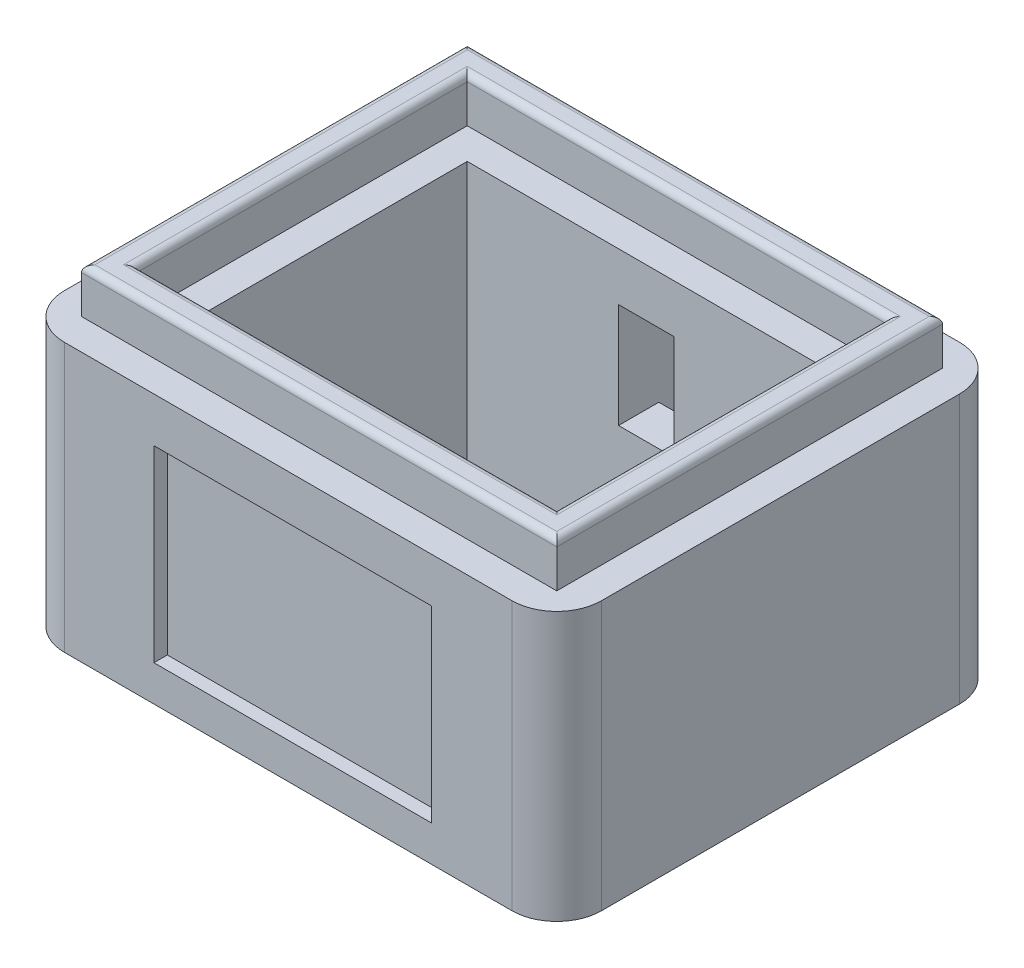
from build123d import *

# Parameters (mm, degrees)
BOSS_EXTRUDE1_DEPTH      = 50
BOSS_EXTRUDE1_DEPTH_BACK = 10
SKETCH1_W                = 120
SKETCH1_H                = 100
FILLET1_R                = 10
SKETCH2_W                = 80
SKETCH2_H                = 60
CUT_EXTRUDE1_DEPTH       = 99.488578018
SKETCH3_W                = 106.2
SKETCH3_H                = 86.2
SKETCH3_W_2              = 93.8
SKETCH3_H_2              = 73.8
CUT_EXTRUDE2_DEPTH       = 10
SKETCH4_W                = 106.2
SKETCH4_H                = 86.2
SKETCH4_W_2              = 93.8
SKETCH4_H_2              = 73.8
BOSS_EXTRUDE2_DEPTH      = 10
FILLET2_R                = 1.5
SKETCH5_W                = 12.4
SKETCH5_H                = 33
CUT_EXTRUDE3_DEPTH       = 11
SKETCH10_W               = 62
SKETCH10_H               = 42
CUT_EXTRUDE7_DEPTH       = 3
CUT_EXTRUDE8_DEPTH       = 20


with BuildPart() as part:
    # Sketch1 → Boss-Extrude1 (new, two sides: drawn at the far end of the back side and taken through both)
    with BuildSketch(Plane(origin=(0, 0, 0), x_dir=(1, 0, 0), z_dir=(0, 1, 0)).offset(-BOSS_EXTRUDE1_DEPTH_BACK)):
        Rectangle(SKETCH1_W, SKETCH1_H)
    extrude(amount=BOSS_EXTRUDE1_DEPTH + BOSS_EXTRUDE1_DEPTH_BACK)

    # Fillet1
    fillet1_edges = [part.edges().sort_by_distance(p)[0] for p in [
        (-60, 20, -50),
        (60, 20, -50),
        (60, 20, 50),
        (-60, 20, 50),
    ]]
    fillet(fillet1_edges, radius=FILLET1_R)

    # Sketch2 → Cut-Extrude1 (cut, through all)
    with BuildSketch(Plane(origin=(0, 50, 0), x_dir=(1, 0, 0), z_dir=(0, 1, 0))):
        Rectangle(SKETCH2_W, SKETCH2_H)
    extrude(amount=-CUT_EXTRUDE1_DEPTH, mode=Mode.SUBTRACT)

    # Sketch3 → Cut-Extrude2 (cut)
    with BuildSketch(Plane.XZ.offset(10)):
        Rectangle(SKETCH3_W, SKETCH3_H)
        Rectangle(SKETCH3_W_2, SKETCH3_H_2, mode=Mode.SUBTRACT)
    extrude(amount=-CUT_EXTRUDE2_DEPTH, mode=Mode.SUBTRACT)

    # Sketch4 → Boss-Extrude2 (add)
    with BuildSketch(Plane(origin=(0, 50, 0), x_dir=(1, 0, 0), z_dir=(0, 1, 0))):
        Rectangle(SKETCH4_W, SKETCH4_H)
        Rectangle(SKETCH4_W_2, SKETCH4_H_2, mode=Mode.SUBTRACT)
    extrude(amount=BOSS_EXTRUDE2_DEPTH)

    # Fillet2
    fillet2_edges = [part.edges().sort_by_distance(p)[0] for p in [
        (-46.9, 60, 0),
        (0, 60, 36.9),
        (46.9, 60, 0),
        (0, 60, -36.9),
        (0, 60, -43.1),
        (-53.1, 60, 0),
        (0, 60, 43.1),
        (53.1, 60, 0),
    ]]
    fillet(fillet2_edges, radius=FILLET2_R)

    # Sketch5 → Cut-Extrude3 (cut)
    with BuildSketch(Plane(origin=(0, 0, -50), x_dir=(-1, 0, 0), z_dir=(0, 0, -1))):
        with Locations((0, 27.5)):
            Rectangle(SKETCH5_W, SKETCH5_H)
    extrude(amount=-CUT_EXTRUDE3_DEPTH, mode=Mode.SUBTRACT)

    # Sketch10 → Cut-Extrude7 (cut)
    with BuildSketch(Plane.XY.offset(50)):
        with Locations((1, 19)):
            Rectangle(SKETCH10_W, SKETCH10_H)
    extrude(amount=-CUT_EXTRUDE7_DEPTH, mode=Mode.SUBTRACT)

    # Sketch9 → Cut-Extrude8 (cut)
    with BuildSketch(Plane(origin=(0, 0, -50), x_dir=(-1, 0, 0), z_dir=(0, 0, -1))):
        Polygon((-6.2, 27.5), (-6.2, 39.2), (6.2, 39.2), (6.2, 15.8), (-6.2, 15.8), align=None)
    extrude(amount=-CUT_EXTRUDE8_DEPTH, mode=Mode.SUBTRACT)


solid = part.part
